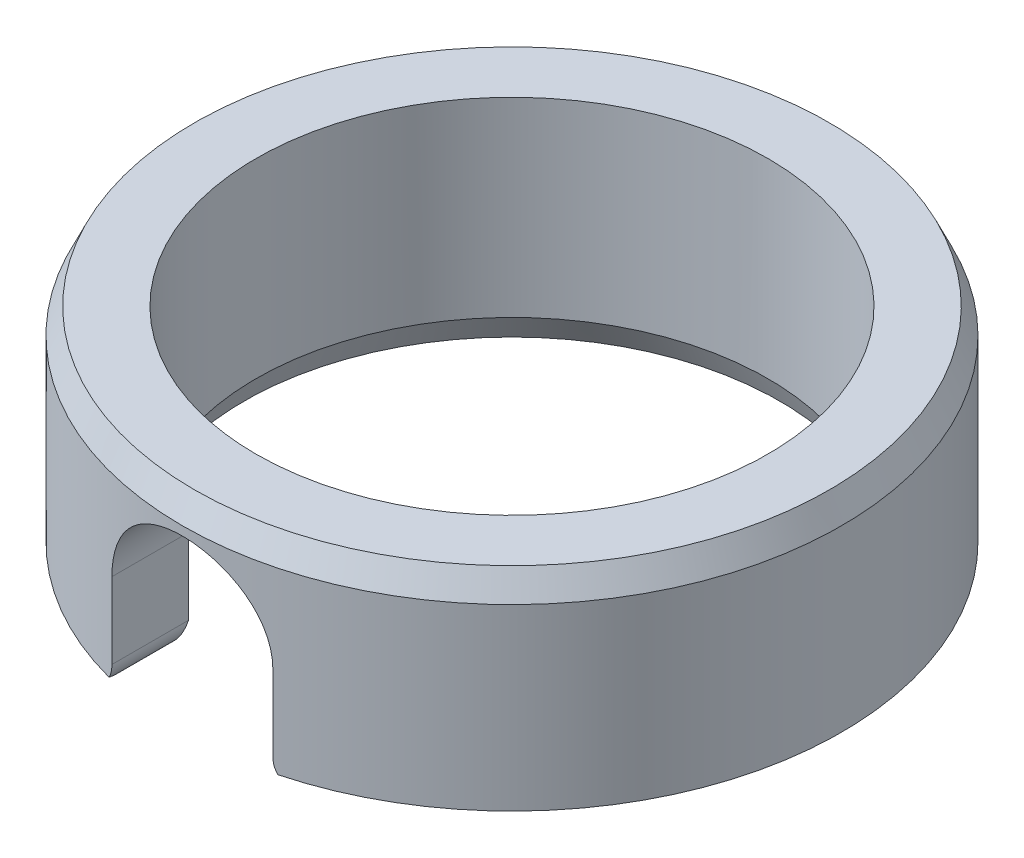
from build123d import *
from OCP.BRepFilletAPI import BRepFilletAPI_MakeChamfer

# Parameters (mm, degrees)
SKETCH1_R           = 13
SKETCH1_R_2         = 10.1
BOSS_EXTRUDE1_DEPTH = 8.5222
CUT_EXTRUDE1_DEPTH  = 21.263955508
CHAMFER1_SIZE       = 1
CHAMFER1_SIZE2      = 0.466307658
FILLET2_R           = 1


with BuildPart() as part:
    # Sketch1 → Boss-Extrude1 (new body)
    with BuildSketch(Plane(origin=(0, 0, 0), x_dir=(1, 0, 0), z_dir=(0, 1, 0))):
        with Locations(Location((0, 0, 0), (0, 0, 270))):
            Circle(SKETCH1_R)
        with Locations(Location((0, 0, 0), (0, 0, 270))):
            Circle(SKETCH1_R_2, mode=Mode.SUBTRACT)
    extrude(amount=BOSS_EXTRUDE1_DEPTH)

    # Sketch2 → Cut-Extrude1 (cut, through all)
    with BuildSketch(Plane.XY):
        with BuildLine():
            Line((-3.175, 4), (-3.175, 0))
            Line((-3.175, 0), (3.175, 0))
            Line((3.175, 0), (3.175, 4))
            ThreePointArc((3.175, 4), (0, 7.175), (-3.175, 4))
        make_face()
    extrude(amount=CUT_EXTRUDE1_DEPTH, mode=Mode.SUBTRACT)

    # Chamfer1: one chamfer whose edges measure the first distance from different faces: ONE call of the kernel's chamfer builder (chamfer() names one face for all edges)
    chamfer1_edges_1 = [part.edges().sort_by_distance(p)[0] for p in [
        (0, 0, -13),
    ]]
    chamfer1_side_1 = [part.faces().sort_by_distance(p)[0] for p in [
        (3.539922426, 0, 11.097151788),
    ]]
    chamfer1_edges_2 = [part.edges().sort_by_distance(p)[0] for p in [
        (0, 8.5222, -13),
    ]]
    chamfer1_side_2 = [part.faces().sort_by_distance(p)[0] for p in [
        (0, 4.2611, -13),
    ]]
    chamfer1_edges_3 = [part.edges().sort_by_distance(p)[0] for p in [
        (0, 0, -10.1),
    ]]
    chamfer1_side_3 = [part.faces().sort_by_distance(p)[0] for p in [
        (0, 4.2611, -10.1),
    ]]
    chamfer1 = BRepFilletAPI_MakeChamfer(part.part.solid().wrapped)
    for e in chamfer1_edges_1:
        chamfer1.Add(CHAMFER1_SIZE, CHAMFER1_SIZE2, e.wrapped, chamfer1_side_1[0].wrapped)  # the first distance lies on this face
    for e in chamfer1_edges_2:
        chamfer1.Add(CHAMFER1_SIZE, CHAMFER1_SIZE2, e.wrapped, chamfer1_side_2[0].wrapped)  # the first distance lies on this face
    for e in chamfer1_edges_3:
        chamfer1.Add(CHAMFER1_SIZE, CHAMFER1_SIZE2, e.wrapped, chamfer1_side_3[0].wrapped)  # the first distance lies on this face
    add(Compound.cast(chamfer1.Shape()), mode=Mode.REPLACE)

    # Fillet2
    fillet2_edges = [part.edges().sort_by_distance(p)[0] for p in [
        (3.175, 0, 10.825180639),
        (-3.175, 0, 10.825180639),
    ]]
    fillet(fillet2_edges, radius=FILLET2_R)


solid = part.part
